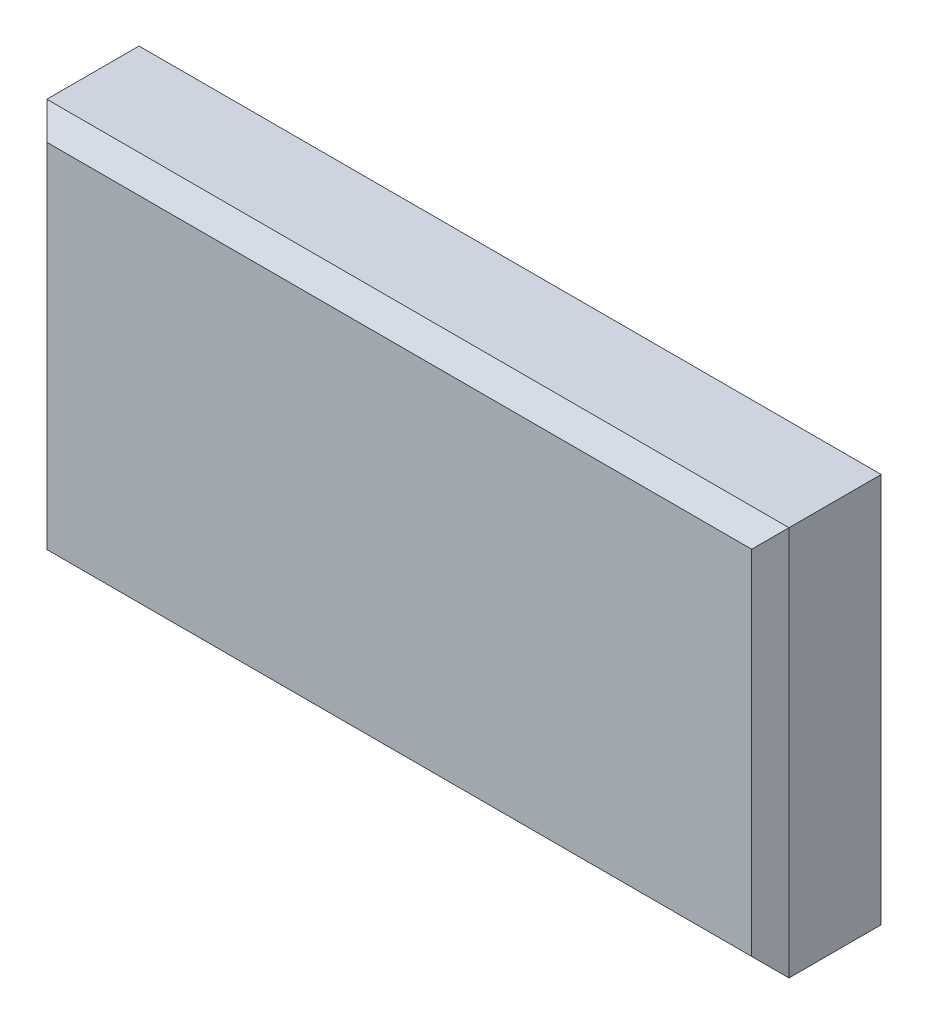
from build123d import *

# Parameters (mm, degrees)
BOSS_EXTRUDE2_DEPTH = 0.059386
CUT_EXTRUDE2_DEPTH  = 1.131952574


with BuildPart() as part:
    # Sketch6 → Boss-Extrude2 (new body)
    with BuildSketch(Plane(origin=(0, -0.029692013, 0), x_dir=(1, 0, 0), z_dir=(0, 1, 0))):
        Polygon((-0.05760873, -0.044406825), (-0.054770597, -0.041568568), (0.052574986, -0.041568568), (0.055413118, -0.044406577), (0.055413118, -0.058446429), (0.052574986, -0.061284671), (-0.054770597, -0.061284671), (-0.05760873, -0.058446647), align=None)
    extrude(amount=BOSS_EXTRUDE2_DEPTH)

    # Sketch10 → Cut-Extrude2 (cut, through all)
    with BuildSketch(Plane(origin=(-0.05760873, 0, 0), x_dir=(0, 0, -1), z_dir=(1, 0, 0))):
        Polygon((-0.061284671, 0.02685612), (-0.058446429, 0.029694371), (-0.061284671, 0.029694371), align=None)
        Polygon((-0.041568568, 0.02685612), (-0.044406577, 0.029694371), (-0.041568568, 0.029694371), align=None)
        Polygon((-0.058446429, -0.029692013), (-0.061284671, -0.026853766), (-0.061284671, -0.029692013), align=None)
        Polygon((-0.044406825, -0.029692013), (-0.041568568, -0.026853766), (-0.041568568, -0.029692013), align=None)
    extrude(amount=CUT_EXTRUDE2_DEPTH, mode=Mode.SUBTRACT)


solid = part.part
